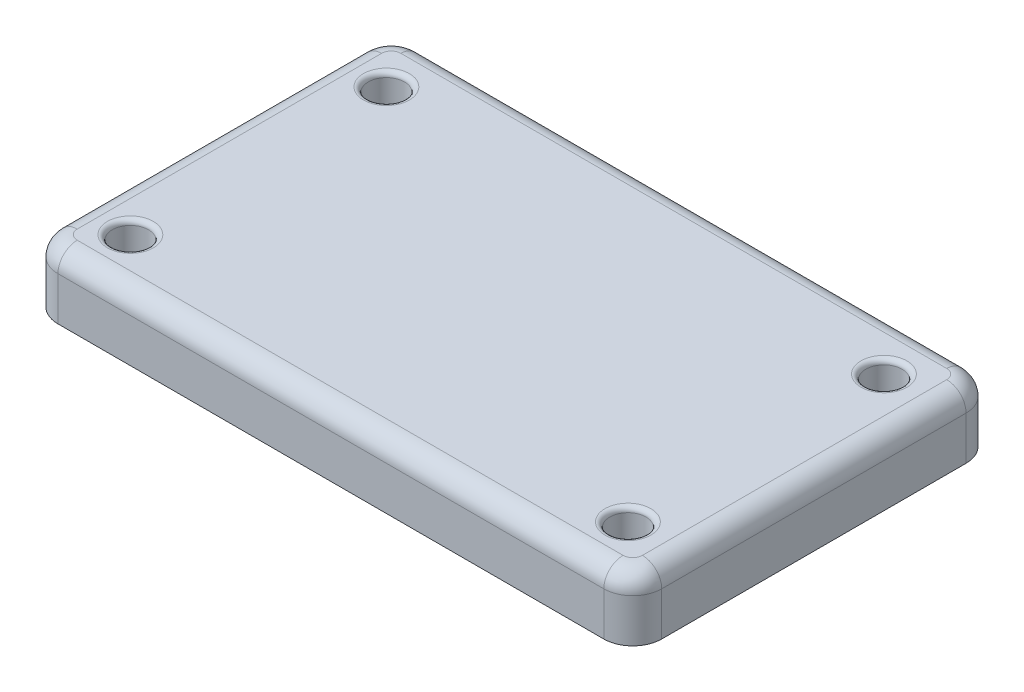
from build123d import *

# Parameters (mm, degrees)
BOSS_EXTRUDE1_DEPTH = 13
CUT_EXTRUDE1_DEPTH  = 11
SKETCH3_R           = 1.35
CUT_EXTRUDE2_DEPTH  = 75.037152836
SKETCH5_R           = 4.25
SKETCH5_R_2         = 1.35
BOSS_EXTRUDE2_DEPTH = 10
SKETCH6_R           = 3.75
CUT_EXTRUDE3_DEPTH  = 6.6
FILLET1_R           = 1
FILLET2_R           = 4
BOSS_EXTRUDE4_DEPTH = 2.5


with BuildPart() as part:
    # Sketch1 → Boss-Extrude1 (new body)
    with BuildSketch(Plane(origin=(0, 0, 0), x_dir=(1, 0, 0), z_dir=(0, 1, 0))):
        with BuildLine():
            Line((-56.5, 37.5), (56.5, 37.5))
            ThreePointArc((56.5, 37.5), (60.742640687, 35.742640687), (62.5, 31.5))
            Line((62.5, 31.5), (62.5, -31.5))
            ThreePointArc((62.5, -31.5), (60.742640687, -35.742640687), (56.5, -37.5))
            Line((56.5, -37.5), (-56.5, -37.5))
            ThreePointArc((-56.5, -37.5), (-60.742640687, -35.742640687), (-62.5, -31.5))
            Line((-62.5, -31.5), (-62.5, 31.5))
            ThreePointArc((-62.5, 31.5), (-60.742640687, 35.742640687), (-56.5, 37.5))
        make_face()
    extrude(amount=BOSS_EXTRUDE1_DEPTH)

    # Sketch2 → Cut-Extrude1 (cut)
    with BuildSketch(Plane.XZ):
        with BuildLine():
            Line((-60.5, 31.5), (-60.5, -31.5))
            ThreePointArc((-60.5, -31.5), (-59.328427125, -34.328427125), (-56.5, -35.5))
            Line((-56.5, -35.5), (56.5, -35.5))
            ThreePointArc((56.5, -35.5), (59.328427125, -34.328427125), (60.5, -31.5))
            Line((60.5, -31.5), (60.5, 31.5))
            ThreePointArc((60.5, 31.5), (59.328427125, 34.328427125), (56.5, 35.5))
            Line((56.5, 35.5), (-56.5, 35.5))
            ThreePointArc((-56.5, 35.5), (-59.328427125, 34.328427125), (-60.5, 31.5))
        make_face()
    extrude(amount=-CUT_EXTRUDE1_DEPTH, mode=Mode.SUBTRACT)

    # Sketch3 → Cut-Extrude2 (cut, through all)
    with BuildSketch(Plane(origin=(0, 13, 0), x_dir=(1, 0, 0), z_dir=(0, 1, 0))):
        with Locations(Location((-52, -27, 0), (0, 0, 270))):
            Circle(SKETCH3_R)
        with Locations(Location((51, -27, 0), (0, 0, 270))):
            Circle(SKETCH3_R)
        with Locations(Location((51, 26, 0), (0, 0, 270))):
            Circle(SKETCH3_R)
        with Locations(Location((-52, 26, 0), (0, 0, 270))):
            Circle(SKETCH3_R)
    extrude(amount=-CUT_EXTRUDE2_DEPTH, mode=Mode.SUBTRACT)

    # Sketch5 → Boss-Extrude2 (add)
    # profile 1 of 8: a face of its own
    with BuildSketch(Plane.XZ.offset(-11)):
        with BuildLine():
            Line((-52, -30.25), (51, -30.25))
            ThreePointArc((51, -30.25), (49.214642893, -29.856812155), (47.759629651, -28.75))
            Line((47.759629651, -28.75), (-48.759629651, -28.75))
            ThreePointArc((-48.759629651, -28.75), (-50.214642893, -29.856812155), (-52, -30.25))
        make_face()
    # profile 2 of 8: a face of its own
    with BuildSketch(Plane.XZ.offset(-11)):
        with Locations((-52, -26)):
            Circle(SKETCH5_R)
        with Locations(Location((-52, -26, 0), (0, 0, 90))):
            Circle(SKETCH5_R_2, mode=Mode.SUBTRACT)
    # profile 3 of 8: a face of its own
    with BuildSketch(Plane.XZ.offset(-11)):
        with BuildLine():
            ThreePointArc((-54.75, 23.759629651), (-55.856812155, 25.214642893), (-56.25, 27))
            Line((-56.25, 27), (-56.25, -26))
            ThreePointArc((-56.25, -26), (-55.856812155, -24.214642893), (-54.75, -22.759629651))
            Line((-54.75, -22.759629651), (-54.75, 23.759629651))
        make_face()
    # profile 4 of 8: a face of its own
    with BuildSketch(Plane.XZ.offset(-11)):
        with Locations((-52, 27)):
            Circle(SKETCH5_R)
        with Locations(Location((-52, 27, 0), (0, 0, 90))):
            Circle(SKETCH5_R_2, mode=Mode.SUBTRACT)
    # profile 5 of 8: a face of its own
    with BuildSketch(Plane.XZ.offset(-11)):
        with BuildLine():
            ThreePointArc((47.759629651, 29.75), (49.214642893, 30.856812155), (51, 31.25))
            Line((51, 31.25), (-52, 31.25))
            ThreePointArc((-52, 31.25), (-50.214642893, 30.856812155), (-48.759629651, 29.75))
            Line((-48.759629651, 29.75), (47.759629651, 29.75))
        make_face()
    # profile 6 of 8: a face of its own
    with BuildSketch(Plane.XZ.offset(-11)):
        with Locations((51, -26)):
            Circle(SKETCH5_R)
        with Locations(Location((51, -26, 0), (0, 0, 90))):
            Circle(SKETCH5_R_2, mode=Mode.SUBTRACT)
    # profile 7 of 8: a face of its own
    with BuildSketch(Plane.XZ.offset(-11)):
        with BuildLine():
            Line((55.25, -26), (55.25, 27))
            ThreePointArc((55.25, 27), (54.856812155, 25.214642893), (53.75, 23.759629651))
            Line((53.75, 23.759629651), (53.75, -22.759629651))
            ThreePointArc((53.75, -22.759629651), (54.856812155, -24.214642893), (55.25, -26))
        make_face()
    # profile 8 of 8: a face of its own
    with BuildSketch(Plane.XZ.offset(-11)):
        with Locations((51, 27)):
            Circle(SKETCH5_R)
        with Locations(Location((51, 27, 0), (0, 0, 90))):
            Circle(SKETCH5_R_2, mode=Mode.SUBTRACT)
    extrude(amount=BOSS_EXTRUDE2_DEPTH)

    # Sketch6 → Cut-Extrude3 (cut)
    with BuildSketch(Plane(origin=(0, 13, 0), x_dir=(1, 0, 0), z_dir=(0, 1, 0))):
        with Locations(Location((51, 26, 0), (0, 0, 270))):
            Circle(SKETCH6_R)
        with Locations(Location((51, -27, 0), (0, 0, 270))):
            Circle(SKETCH6_R)
        with Locations(Location((-52, 26, 0), (0, 0, 270))):
            Circle(SKETCH6_R)
        with Locations(Location((-52, -27, 0), (0, 0, 270))):
            Circle(SKETCH6_R)
    extrude(amount=-CUT_EXTRUDE3_DEPTH, mode=Mode.SUBTRACT)

    # Fillet1
    fillet1_edges = [part.edges().sort_by_distance(p)[0] for p in [
        (51, 13, 23.25),
        (-52, 13, -29.75),
        (-52, 13, 23.25),
        (51, 13, -29.75),
    ]]
    fillet(fillet1_edges, radius=FILLET1_R)

    # Fillet2
    fillet2_edges = [part.edges().sort_by_distance(p)[0] for p in [
        (60.742640687, 13, 35.742640687),
        (62.5, 13, 0),
        (60.742640687, 13, -35.742640687),
        (0, 13, -37.5),
        (-60.742640687, 13, -35.742640687),
        (-62.5, 13, 0),
        (-60.742640687, 13, 35.742640687),
        (0, 13, 37.5),
    ]]
    fillet(fillet2_edges, radius=FILLET2_R)

    # Sketch8 → Boss-Extrude4 (add)
    with BuildSketch(Plane.XZ.offset(-11)):
        with BuildLine():
            Line((-60.5, 31.5), (-60.5, -31.5))
            ThreePointArc((-60.5, -31.5), (-59.328427125, -34.328427125), (-56.5, -35.5))
            Line((-56.5, -35.5), (56.5, -35.5))
            ThreePointArc((56.5, -35.5), (59.328427125, -34.328427125), (60.5, -31.5))
            Line((60.5, -31.5), (60.5, 31.5))
            ThreePointArc((60.5, 31.5), (59.328427125, 34.328427125), (56.5, 35.5))
            Line((56.5, 35.5), (-56.5, 35.5))
            ThreePointArc((-56.5, 35.5), (-59.328427125, 34.328427125), (-60.5, 31.5))
        make_face()
        with BuildLine():
            Line((55.25, 27), (55.25, -26))
            ThreePointArc((55.25, -26), (54.00520382, -29.00520382), (51, -30.25))
            Line((51, -30.25), (-52, -30.25))
            ThreePointArc((-52, -30.25), (-55.00520382, -29.00520382), (-56.25, -26))
            Line((-56.25, -26), (-56.25, 27))
            ThreePointArc((-56.25, 27), (-55.00520382, 30.00520382), (-52, 31.25))
            Line((-52, 31.25), (51, 31.25))
            ThreePointArc((51, 31.25), (54.00520382, 30.00520382), (55.25, 27))
        make_face(mode=Mode.SUBTRACT)
    extrude(amount=BOSS_EXTRUDE4_DEPTH)


solid = part.part
